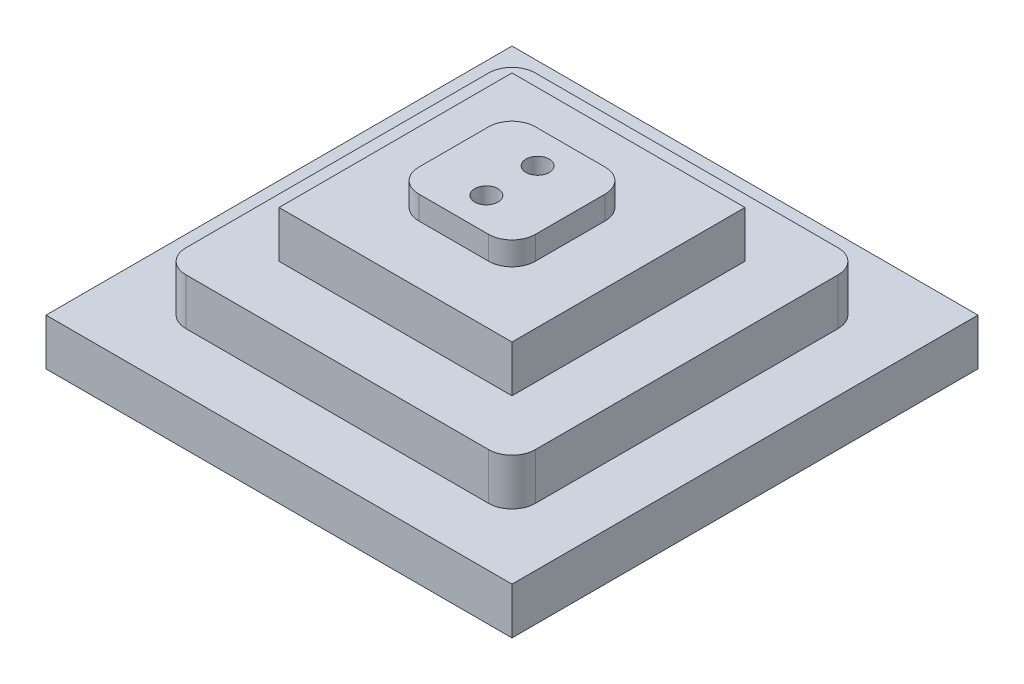
from build123d import *

# Parameters (mm, degrees)
SKETCH1_W           = 100
SKETCH1_H           = 100
BOSS_EXTRUDE1_DEPTH = 10
SKETCH2_W           = 75
SKETCH2_H           = 75
BOSS_EXTRUDE2_DEPTH = 10
SKETCH3_W           = 50
SKETCH3_H           = 50
BOSS_EXTRUDE3_DEPTH = 10
SKETCH4_W           = 25
SKETCH4_H           = 25
BOSS_EXTRUDE4_DEPTH = 5
SKETCH5_R           = 2.5
CUT_EXTRUDE1_DEPTH  = 25
SKETCH6_R           = 1.5
CUT_EXTRUDE2_DEPTH  = 10
FILLET2_R           = 5


with BuildPart() as part:
    # Sketch1 → Boss-Extrude1 (new body)
    with BuildSketch(Plane(origin=(0, 0, 0), x_dir=(1, 0, 0), z_dir=(0, 1, 0))):
        with Locations((50, 50)):
            Rectangle(SKETCH1_W, SKETCH1_H)
    extrude(amount=BOSS_EXTRUDE1_DEPTH)

    # Sketch2 → Boss-Extrude2 (add)
    with BuildSketch(Plane(origin=(0, 10, 0), x_dir=(1, 0, 0), z_dir=(0, 1, 0))):
        with Locations((50, 50)):
            Rectangle(SKETCH2_W, SKETCH2_H)
    extrude(amount=BOSS_EXTRUDE2_DEPTH)

    # Sketch3 → Boss-Extrude3 (add)
    with BuildSketch(Plane(origin=(0, 20, 0), x_dir=(1, 0, 0), z_dir=(0, 1, 0))):
        with Locations((50, 50)):
            Rectangle(SKETCH3_W, SKETCH3_H)
    extrude(amount=BOSS_EXTRUDE3_DEPTH)

    # Sketch4 → Boss-Extrude4 (add)
    with BuildSketch(Plane(origin=(0, 30, 0), x_dir=(1, 0, 0), z_dir=(0, 1, 0))):
        with Locations((50, 50)):
            Rectangle(SKETCH4_W, SKETCH4_H)
    extrude(amount=BOSS_EXTRUDE4_DEPTH)

    # Sketch5 → Cut-Extrude1 (cut)
    with BuildSketch(Plane(origin=(0, 35, 0), x_dir=(1, 0, 0), z_dir=(0, 1, 0))):
        with Locations(Location((50, 55.5, 0), (0, 0, 270))):
            Circle(SKETCH5_R)
        with Locations(Location((50, 44.5, 0), (0, 0, 270))):
            Circle(SKETCH5_R)
    extrude(amount=-CUT_EXTRUDE1_DEPTH, mode=Mode.SUBTRACT)

    # Sketch6 → Cut-Extrude2 (cut)
    with BuildSketch(Plane(origin=(0, 10, 0), x_dir=(1, 0, 0), z_dir=(0, 1, 0))):
        with Locations(Location((50, 55.5, 0), (0, 0, 270))):
            Circle(SKETCH6_R)
        with Locations(Location((50, 44.5, 0), (0, 0, 270))):
            Circle(SKETCH6_R)
    extrude(amount=-CUT_EXTRUDE2_DEPTH, mode=Mode.SUBTRACT)

    # Fillet2
    fillet2_edges = [part.edges().sort_by_distance(p)[0] for p in [
        (12.5, 15, -87.5),
        (12.5, 15, -12.5),
        (87.5, 15, -12.5),
        (87.5, 15, -87.5),
        (37.5, 32.5, -62.5),
        (37.5, 32.5, -37.5),
        (62.5, 32.5, -37.5),
        (62.5, 32.5, -62.5),
    ]]
    fillet(fillet2_edges, radius=FILLET2_R)


solid = part.part
